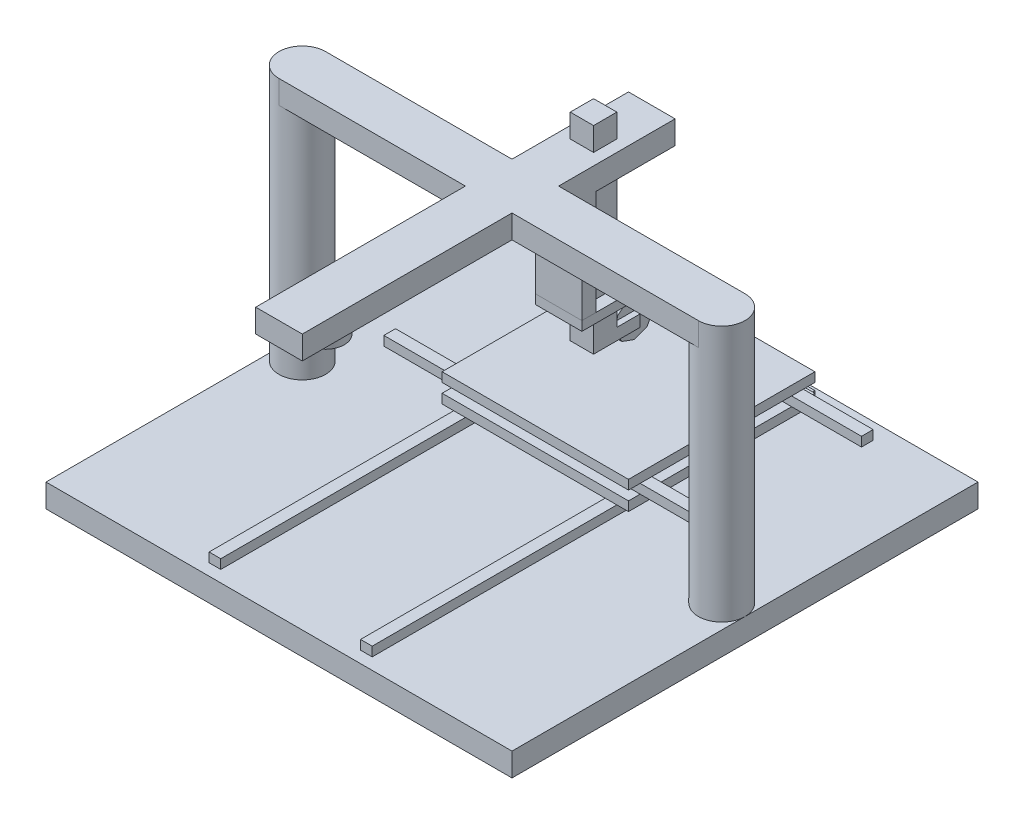
from build123d import *

# Parameters (mm, degrees)
SKETCH3_W            = 100
SKETCH3_H            = 100
BOSS_EXTRUDE1_DEPTH  = 5
SKETCH6_R            = 5
BOSS_EXTRUDE3_DEPTH  = 55
SKETCH9_R            = 5
BOSS_EXTRUDE4_DEPTH  = 55
SKETCH20_W           = 90
SKETCH20_H           = 10
BOSS_EXTRUDE6_DEPTH  = 5
SKETCH21_R           = 5
BOSS_EXTRUDE7_DEPTH  = 5
SKETCH22_R           = 5
BOSS_EXTRUDE8_DEPTH  = 5
SKETCH24_W           = 10
SKETCH24_H           = 80
BOSS_EXTRUDE9_DEPTH  = 5
SKETCH27_R           = 4
BOSS_EXTRUDE11_DEPTH = 2.5
BOSS_EXTRUDE16_DEPTH = 2
SKETCH31_W           = 2.5
SKETCH31_H           = 95
BOSS_EXTRUDE17_DEPTH = 2
SKETCH32_W           = 2.5
SKETCH32_H           = 95
BOSS_EXTRUDE18_DEPTH = 2
BOSS_EXTRUDE19_DEPTH = 2
BOSS_EXTRUDE20_DEPTH = 2
BOSS_EXTRUDE21_DEPTH = 2
BOSS_EXTRUDE23_DEPTH = 42.5
SKETCH33_W           = 5
SKETCH33_H           = 5
CUT_EXTRUDE2_DEPTH   = 5
BOSS_EXTRUDE24_DEPTH = 3
BOSS_EXTRUDE25_DEPTH = 1.25
BOSS_EXTRUDE26_DEPTH = 1.25
BOSS_EXTRUDE28_DEPTH = 2.5
SKETCH37_R           = 0.5
CUT_EXTRUDE3_DEPTH   = 2.5
BOSS_EXTRUDE31_DEPTH = 2
SKETCH38_W           = 4
SKETCH38_H           = 4
CUT_EXTRUDE4_DEPTH   = 2
BOSS_EXTRUDE32_DEPTH = 4.5


with BuildPart() as part:
    # Sketch3 → Boss-Extrude1 (new body)
    with BuildSketch(Plane(origin=(0, 0, 0), x_dir=(1, 0, 0), z_dir=(0, 1, 0))):
        with Locations((50, 50)):
            Rectangle(SKETCH3_W, SKETCH3_H)
    extrude(amount=BOSS_EXTRUDE1_DEPTH)

    # Sketch6 → Boss-Extrude3 (add)
    with BuildSketch(Plane(origin=(0, 0, 0), x_dir=(-1, 0, 0), z_dir=(0, -1, 0))):
        with Locations(Location((-5, 50, 0), (0, 0, 90))):
            Circle(SKETCH6_R)
    extrude(amount=-BOSS_EXTRUDE3_DEPTH)

    # Sketch9 → Boss-Extrude4 (add)
    with BuildSketch(Plane(origin=(0, 0, 0), x_dir=(-1, 0, 0), z_dir=(0, -1, 0))):
        with Locations(Location((-95, 50, 0), (0, 0, 90))):
            Circle(SKETCH9_R)
    extrude(amount=-BOSS_EXTRUDE4_DEPTH)

    # Sketch20 → Boss-Extrude6 (add)
    with BuildSketch(Plane(origin=(0, 55, 0), x_dir=(1, 0, 0), z_dir=(0, 1, 0))):
        with Locations((50, 50)):
            Rectangle(SKETCH20_W, SKETCH20_H)
    extrude(amount=BOSS_EXTRUDE6_DEPTH)

    # Sketch21 → Boss-Extrude7 (add)
    with BuildSketch(Plane(origin=(0, 55, 0), x_dir=(1, 0, 0), z_dir=(0, 1, 0))):
        with Locations(Location((5, 50, 0), (0, 0, 90))):
            Circle(SKETCH21_R)
    extrude(amount=BOSS_EXTRUDE7_DEPTH)

    # Sketch22 → Boss-Extrude8 (add)
    with BuildSketch(Plane(origin=(0, 55, 0), x_dir=(1, 0, 0), z_dir=(0, 1, 0))):
        with Locations(Location((95, 50, 0), (0, 0, 90))):
            Circle(SKETCH22_R)
    extrude(amount=BOSS_EXTRUDE8_DEPTH)

    # Sketch24 → Boss-Extrude9 (add)
    with BuildSketch(Plane(origin=(0, 55, 0), x_dir=(-1, 0, 0), z_dir=(0, -1, 0))):
        with Locations((-50, 40)):
            Rectangle(SKETCH24_W, SKETCH24_H)
    extrude(amount=-BOSS_EXTRUDE9_DEPTH)

    # Sketch27 → Boss-Extrude11 (add)
    with BuildSketch(Plane(origin=(0, 55, 0), x_dir=(-1, 0, 0), z_dir=(0, -1, 0))):
        with Locations(Location((-50, 10, 0), (0, 0, 90))):
            Circle(SKETCH27_R)
    extrude(amount=BOSS_EXTRUDE11_DEPTH)



with BuildPart() as body_2:
    # 3DSketch5 → Boss-Extrude16 (new body)
    with BuildSketch(Plane(origin=(30, 7, -55), x_dir=(0.7071067811865476, 0, -0.7071067811865475), z_dir=(0, 1, 0))):
        Polygon((0, 0), (28.284271247, 28.284271247), (56.568542495, 0), (28.284271247, -28.284271247), align=None)
    extrude(amount=BOSS_EXTRUDE16_DEPTH)


with BuildPart() as part_1:
    add(part.part)

    add(body_2.part)  # Boss-Extrude17 merges body 2
    # Sketch31 → Boss-Extrude17 (add)
    with BuildSketch(Plane(origin=(0, 5, 0), x_dir=(1, 0, 0), z_dir=(0, 1, 0))):
        with Locations((33.75, 50)):
            Rectangle(SKETCH31_W, SKETCH31_H)
    extrude(amount=BOSS_EXTRUDE17_DEPTH)

    # Sketch32 → Boss-Extrude18 (add)
    with BuildSketch(Plane(origin=(0, 5, 0), x_dir=(1, 0, 0), z_dir=(0, 1, 0))):
        with Locations((66.25, 50)):
            Rectangle(SKETCH32_W, SKETCH32_H)
    extrude(amount=BOSS_EXTRUDE18_DEPTH)

    # 3DSketch6 → Boss-Extrude19 (add)
    with BuildSketch(Plane(origin=(15, 9, -90), x_dir=(0.9993628543475496, 0, -0.035691530512412514), z_dir=(0, 1, 0))):
        Polygon((0, 0), (0.089228826, 2.498407136), (70.044628631, 0), (69.955399804, -2.498407136), align=None)
    extrude(amount=BOSS_EXTRUDE19_DEPTH)

    # 3DSketch7 → Boss-Extrude20 (add)
    with BuildSketch(Plane(origin=(15, 9, -60), x_dir=(0.9993628543475496, 0, 0.035691530512412514), z_dir=(0, 1, 0))):
        Polygon((0, 0), (0.089228826, -2.498407136), (70.044628631, 0), (69.955399804, 2.498407136), align=None)
    extrude(amount=BOSS_EXTRUDE20_DEPTH)

    # 3DSketch10 → Boss-Extrude21 (add)
    with BuildSketch(Plane(origin=(30, 11, -95), x_dir=(0.7071067811865476, 0, 0.7071067811865475), z_dir=(0, -1, 0))):
        Polygon((0, 0), (28.284271247, 28.284271247), (56.568542495, 0), (28.284271247, -28.284271247), align=None)
    extrude(amount=-BOSS_EXTRUDE21_DEPTH)

    # 3DSketch15 → Boss-Extrude23 (add)
    with BuildSketch(Plane(origin=(52.5, 65, -65), x_dir=(-0.707106781186547, 0, -0.707106781186548), z_dir=(0, -1, 0))):
        Polygon((0, 0), (3.535533906, 3.535533906), (7.071067812, 0), (3.535533906, -3.535533906), align=None)
    extrude(amount=BOSS_EXTRUDE23_DEPTH)

    # Sketch33 → Cut-Extrude2 (cut)
    with BuildSketch(Plane(origin=(0, 60, 0), x_dir=(1, 0, 0), z_dir=(0, 1, 0))):
        with Locations((50, 67.5)):
            Rectangle(SKETCH33_W, SKETCH33_H)
    extrude(amount=-CUT_EXTRUDE2_DEPTH, mode=Mode.SUBTRACT)


with BuildPart() as cut_extrude2_piece_1:
    # of the separate pieces the step leaves, piece 1, a body of its own (cut_extrude2_pieces)
    add(part_1.part.solids().sort_by_distance((0, 0, 0))[0])

    # 3DSketch16 → Boss-Extrude24 (add)
    with BuildSketch(Plane(origin=(45, 55, -60), x_dir=(0.4061384660534477, -0.9138115486202572, 0), z_dir=(0, 0, 1))):
        Polygon((0, 0), (4.061384661, 9.138115486), (24.622144504, 0), (20.560759844, -9.138115486), align=None)
    extrude(amount=-BOSS_EXTRUDE24_DEPTH)


with BuildPart() as cut_extrude2_piece_2:
    # of the separate pieces the step leaves, piece 2, a body of its own (cut_extrude2_pieces)
    add(part_1.part.solids().sort_by_distance((52.5, 22.5, -70))[0])

    # 3DSketch17 → Boss-Extrude25 (add)
    with BuildSketch(Plane(origin=(52.5, 22.5, -70), x_dir=(0, 0.4472135954999585, -0.8944271909999156), z_dir=(1, 0, 0))):
        Polygon((0, 0), (1.118033989, 2.236067977), (5.590169944, 0), (4.472135955, -2.236067977), align=None)
    extrude(amount=-BOSS_EXTRUDE25_DEPTH)



with BuildPart() as cut_extrude2_piece_3:
    # of the separate pieces the step leaves, piece 3, a body of its own (cut_extrude2_pieces)
    add(part_1.part.solids().sort_by_distance((52.5, 65, -65))[0])


with BuildPart() as body_4:
    # 3DSketch18 → Boss-Extrude26 (new body)
    with BuildSketch(Plane(origin=(47.5, 22.5, -70), x_dir=(0, 0.4472135954999585, -0.8944271909999156), z_dir=(1, 0, 0))):
        Polygon((0, 0), (1.118033989, 2.236067977), (5.590169944, 0), (4.472135955, -2.236067977), align=None)
    extrude(amount=BOSS_EXTRUDE26_DEPTH)


with BuildPart() as cut_extrude2_piece_2_1:
    add(cut_extrude2_piece_2.part)

    add(body_4.part)  # Boss-Extrude28 merges body 4
    # Sketch36 → Boss-Extrude28 (add)
    with BuildSketch(Plane(origin=(48.75, 0, 0), x_dir=(0, 0, -1), z_dir=(1, 0, 0))):
        Polygon((76.419636818, 27.6504201), (73.580363182, 27.6504201), (71.405353392, 25.825370187), (70.912318699, 23.029231498), (72.331955517, 20.570348402), (75, 19.599259626), (77.668044483, 20.570348402), (79.087681301, 23.029231498), (78.594646608, 25.825370187), align=None)
    extrude(amount=BOSS_EXTRUDE28_DEPTH)

    # Sketch37 → Cut-Extrude3 (cut)
    with BuildSketch(Plane.ZY.offset(-48.75)):
        with Locations(Location((-75, 23.75, 0), (0, 0, 90))):
            Circle(SKETCH37_R)
    extrude(amount=-CUT_EXTRUDE3_DEPTH, mode=Mode.SUBTRACT)


with BuildPart() as body_4_2:
    # 3DSketch28 → Boss-Extrude31 (new body)
    with BuildSketch(Plane(origin=(55, 32.5, -60), x_dir=(-0.447213595499958, 0, -0.894427190999916), z_dir=(0, -1, 0))):
        Polygon((0, 0), (17.88854382, 8.94427191), (22.360679775, 0), (4.472135955, -8.94427191), align=None)
    extrude(amount=BOSS_EXTRUDE31_DEPTH)

    # Sketch38 → Cut-Extrude4 (cut)
    with BuildSketch(Plane(origin=(0, 32.5, 0), x_dir=(1, 0, 0), z_dir=(0, 1, 0))):
        with Locations((50, 75)):
            Rectangle(SKETCH38_W, SKETCH38_H)
    extrude(amount=-CUT_EXTRUDE4_DEPTH, mode=Mode.SUBTRACT)


with BuildPart() as body_5:
    # 3DSketch30 → Boss-Extrude32 (new body)
    with BuildSketch(Plane(origin=(52, 34, -73), x_dir=(-0.7071067811865469, 0, -0.7071067811865481), z_dir=(0, -1, 0))):
        Polygon((0, 0), (2.828427125, 2.828427125), (5.656854249, 0), (2.828427125, -2.828427125), align=None)
    extrude(amount=BOSS_EXTRUDE32_DEPTH)


solid = Compound([cut_extrude2_piece_1.part, cut_extrude2_piece_3.part, cut_extrude2_piece_2_1.part, body_4_2.part, body_5.part])
